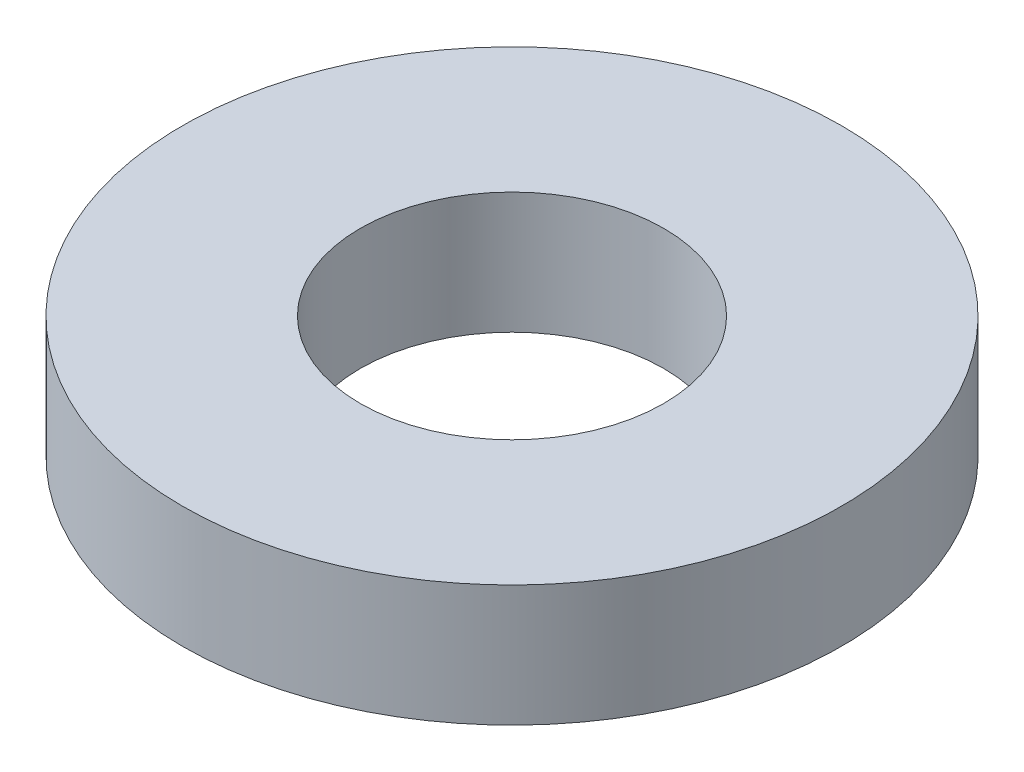
from build123d import *

# Parameters (mm, degrees)
SKETCH1_R           = 6.8961
SKETCH1_R_2         = 3.175
BOSS_EXTRUDE1_DEPTH = 2.54


with BuildPart() as part:
    # Sketch1 → Boss-Extrude1 (new body)
    with BuildSketch(Plane(origin=(0, 0, 0), x_dir=(1, 0, 0), z_dir=(0, 1, 0))):
        with Locations(Location((0, 0, 0), (0, 0, 270))):
            Circle(SKETCH1_R)
        with Locations(Location((0, 0, 0), (0, 0, 270))):
            Circle(SKETCH1_R_2, mode=Mode.SUBTRACT)
    extrude(amount=BOSS_EXTRUDE1_DEPTH)


solid = part.part
